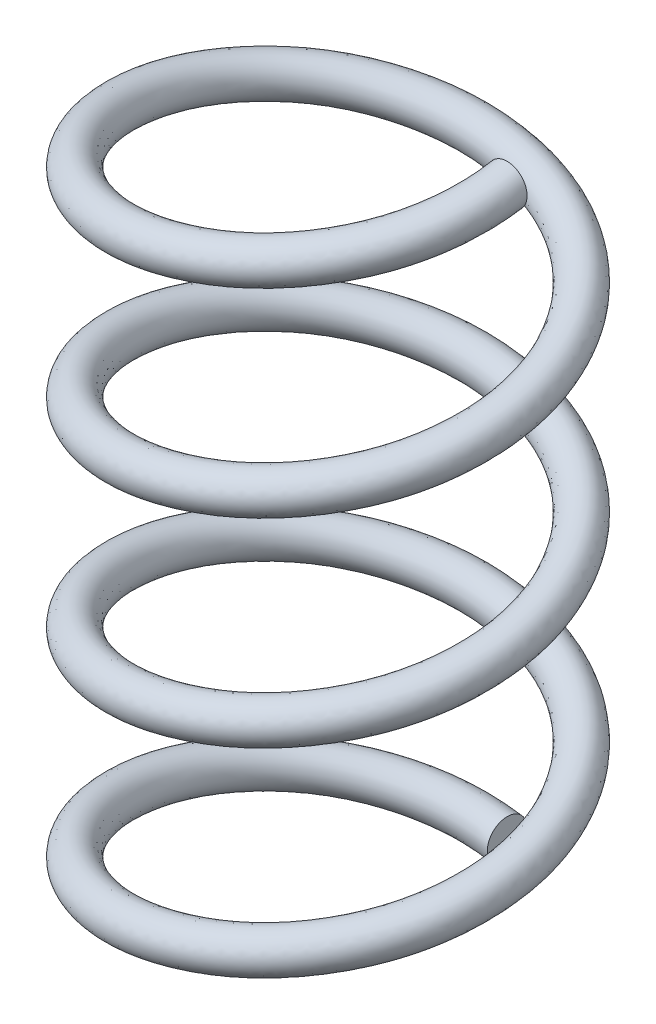
from build123d import *

# Parameters (mm, degrees)
SPRING_PITCH          = 2
SPRING_HEIGHT         = 7.5
SPRING_RADIUS         = 1.8
SPRING_START_ANGLE    = 90
SPRINGBODYDIAMETERS_R = 0.2


with BuildPart() as part:
    # SPRING: sweep along a helix
    with BuildLine() as spring_path:
        add(Helix(SPRING_PITCH, SPRING_HEIGHT, SPRING_RADIUS, center=(0, 0, 0), direction=(0, -1, 0), mode=Mode.PRIVATE).rotate(Axis((0, 0, 0), (0, -1, 0)), SPRING_START_ANGLE))
    # SpringBodyDiameterS → SPRING (sweep)
    with BuildSketch(Plane.XY):
        with Locations((1.8, 0)):
            Circle(SPRINGBODYDIAMETERS_R)
    sweep(path=spring_path.line, is_frenet=True)


solid = part.part
